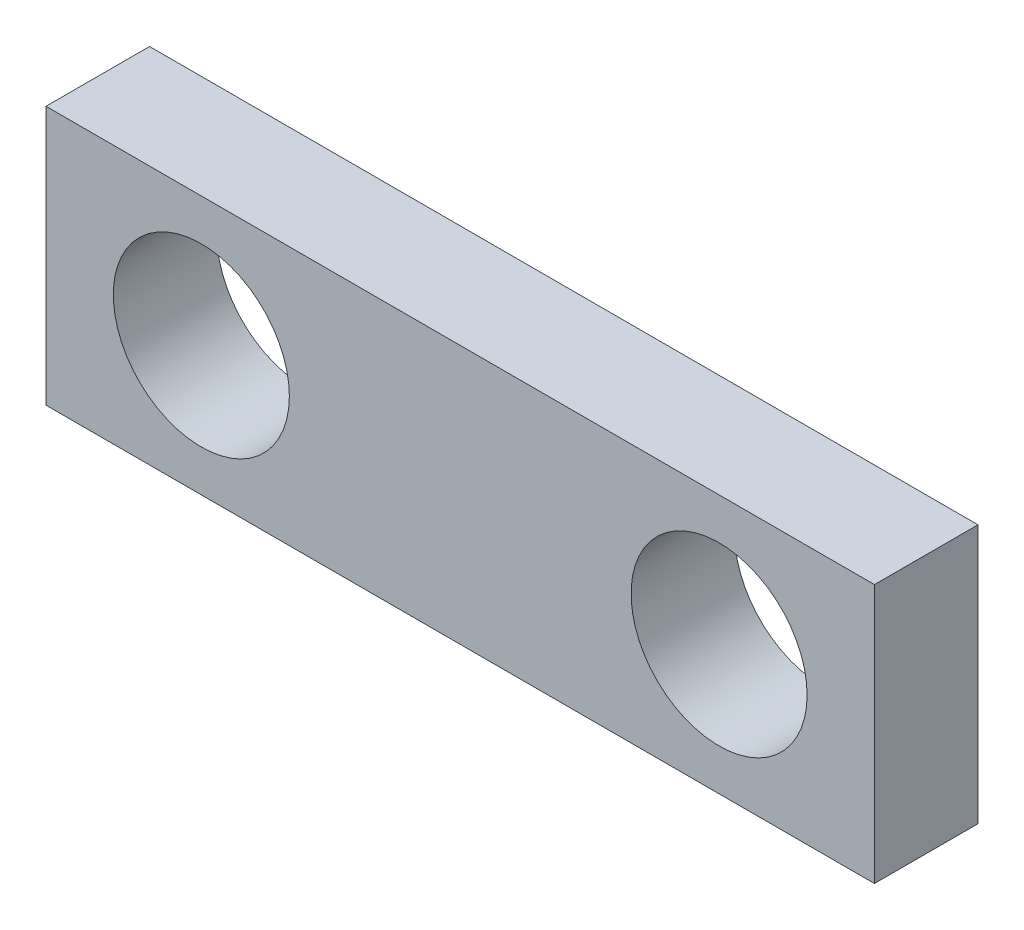
from build123d import *

# Parameters (mm, degrees)
SKIZZE1_W                       = 16
SKIZZE1_H                       = 5
AUFSATZ_LINEAR_AUSTRAGEN1_DEPTH = 2
DURCHGANGSLOCH_F_R_M31_D        = 3.4


with BuildPart() as part:
    # Skizze1 → Aufsatz-Linear austragen1 (new body)
    with BuildSketch(Plane.XY):
        with Locations((8, 2.5)):
            Rectangle(SKIZZE1_W, SKIZZE1_H)
    extrude(amount=AUFSATZ_LINEAR_AUSTRAGEN1_DEPTH)

    # Durchgangsloch für M31 (through all)
    with Locations(Plane.XY.offset(2)):
        with Locations((3, 2.5), (13, 2.5)):
            Hole(DURCHGANGSLOCH_F_R_M31_D / 2)


solid = part.part
